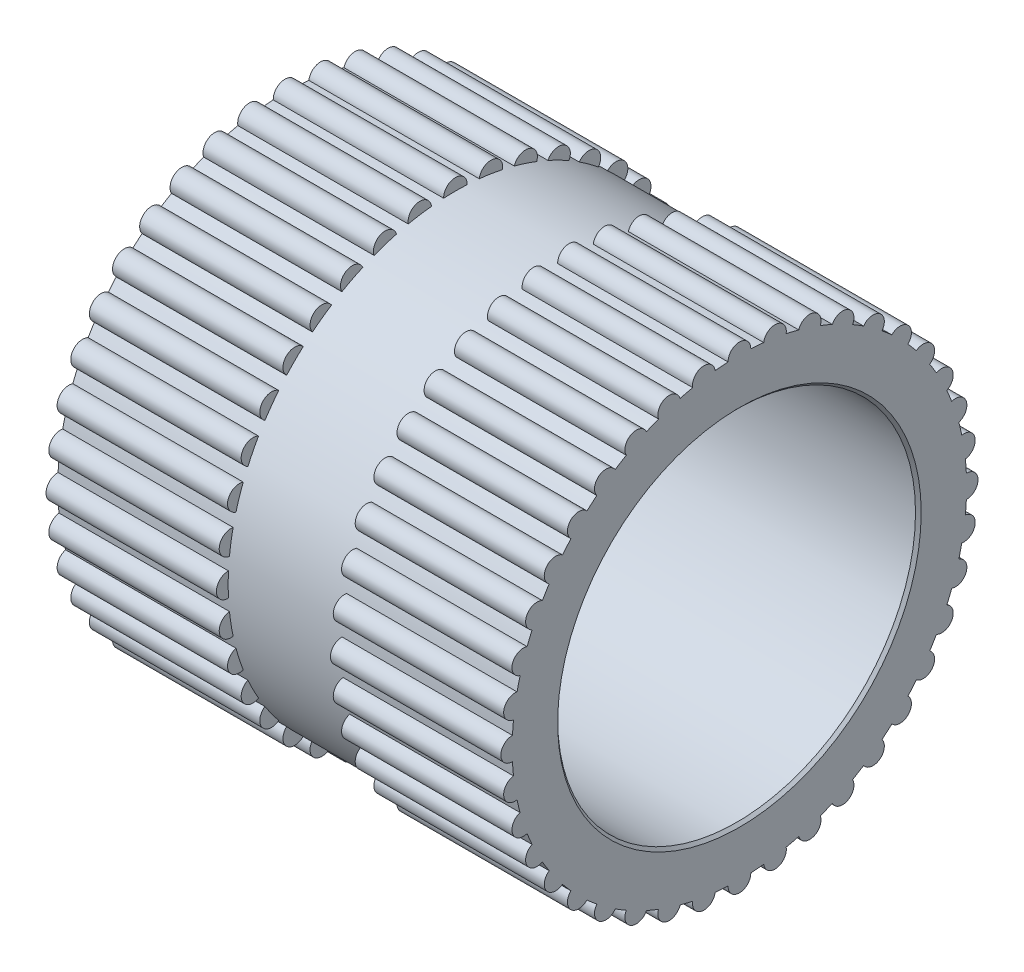
from build123d import *

# Parameters (mm, degrees)
SKETCH_1_R                  = 2
EXTRUDE_1_DEPTH             = 4
HOLE_WIZARD_M31_D           = 3.15
HOLE_WIZARD_M31_CSINK_D     = 3.2
HOLE_WIZARD_M31_CSINK_ANGLE = 90
SKETCH_4_R                  = 0.1
EXTRUDE_2_DEPTH             = 1.5
SKETCH_5_R                  = 0.103701004
EXTRUDE_3_DEPTH             = 1.5


with BuildPart() as part:
    # Эскиз1 → Бобышка-Вытянуть1 (new body)
    with BuildSketch(Plane(origin=(0, 0, 0), x_dir=(0, 0, -1), z_dir=(1, 0, 0))):
        Circle(SKETCH_1_R)
    extrude(amount=EXTRUDE_1_DEPTH)

    # Сверло под метчик  спиральное M31 (through all)
    with Locations(Plane(origin=(4, 0, 0), x_dir=(0, 0, -1), z_dir=(1, 0, 0))):
        with Locations((0, 0)):
            CounterSinkHole(HOLE_WIZARD_M31_D / 2, HOLE_WIZARD_M31_CSINK_D / 2, counter_sink_angle=HOLE_WIZARD_M31_CSINK_ANGLE)

    # Эскиз4 → Бобышка-Вытянуть2 (add)
    with BuildSketch(Plane(origin=(4, 0, 0), x_dir=(0, 0, -1), z_dir=(1, 0, 0))):
        with Locations((0, 2)):
            Circle(SKETCH_4_R)
        with Locations((0.31286893, 1.975376681)):
            Circle(SKETCH_4_R)
        with Locations((0.618033989, 1.902113033)):
            Circle(SKETCH_4_R)
        with Locations((0.907980999, 1.782013048)):
            Circle(SKETCH_4_R)
        with Locations((1.175570505, 1.618033989)):
            Circle(SKETCH_4_R)
        with Locations((1.414213562, 1.414213562)):
            Circle(SKETCH_4_R)
        with Locations((1.618033989, 1.175570505)):
            Circle(SKETCH_4_R)
        with Locations((1.782013048, 0.907980999)):
            Circle(SKETCH_4_R)
        with Locations((1.902113033, 0.618033989)):
            Circle(SKETCH_4_R)
        with Locations((1.975376681, 0.31286893)):
            Circle(SKETCH_4_R)
        with Locations((2, 0)):
            Circle(SKETCH_4_R)
        with Locations((1.975376681, -0.31286893)):
            Circle(SKETCH_4_R)
        with Locations((1.902113033, -0.618033989)):
            Circle(SKETCH_4_R)
        with Locations((1.782013048, -0.907980999)):
            Circle(SKETCH_4_R)
        with Locations((1.618033989, -1.175570505)):
            Circle(SKETCH_4_R)
        with Locations((1.414213562, -1.414213562)):
            Circle(SKETCH_4_R)
        with Locations((1.175570505, -1.618033989)):
            Circle(SKETCH_4_R)
        with Locations((0.907980999, -1.782013048)):
            Circle(SKETCH_4_R)
        with Locations((0.618033989, -1.902113033)):
            Circle(SKETCH_4_R)
        with Locations((0.31286893, -1.975376681)):
            Circle(SKETCH_4_R)
        with Locations((0, -2)):
            Circle(SKETCH_4_R)
        with Locations((-0.31286893, -1.975376681)):
            Circle(SKETCH_4_R)
        with Locations((-0.618033989, -1.902113033)):
            Circle(SKETCH_4_R)
        with Locations((-0.907980999, -1.782013048)):
            Circle(SKETCH_4_R)
        with Locations((-1.175570505, -1.618033989)):
            Circle(SKETCH_4_R)
        with Locations((-1.414213562, -1.414213562)):
            Circle(SKETCH_4_R)
        with Locations((-1.618033989, -1.175570505)):
            Circle(SKETCH_4_R)
        with Locations((-1.782013048, -0.907980999)):
            Circle(SKETCH_4_R)
        with Locations((-1.902113033, -0.618033989)):
            Circle(SKETCH_4_R)
        with Locations((-1.975376681, -0.31286893)):
            Circle(SKETCH_4_R)
        with Locations((-2, 0)):
            Circle(SKETCH_4_R)
        with Locations((-1.975376681, 0.31286893)):
            Circle(SKETCH_4_R)
        with Locations((-1.902113033, 0.618033989)):
            Circle(SKETCH_4_R)
        with Locations((-1.782013048, 0.907980999)):
            Circle(SKETCH_4_R)
        with Locations((-1.618033989, 1.175570505)):
            Circle(SKETCH_4_R)
        with Locations((-1.414213562, 1.414213562)):
            Circle(SKETCH_4_R)
        with Locations((-1.175570505, 1.618033989)):
            Circle(SKETCH_4_R)
        with Locations((-0.907980999, 1.782013048)):
            Circle(SKETCH_4_R)
        with Locations((-0.618033989, 1.902113033)):
            Circle(SKETCH_4_R)
        with Locations((-0.31286893, 1.975376681)):
            Circle(SKETCH_4_R)
    extrude(amount=-EXTRUDE_2_DEPTH)

    # Эскиз5 → Бобышка-Вытянуть3 (add)
    with BuildSketch(Plane.ZY):
        with Locations((0, 2)):
            Circle(SKETCH_5_R)
        with Locations((0.31286893, 1.975376681)):
            Circle(SKETCH_5_R)
        with Locations((0.618033989, 1.902113033)):
            Circle(SKETCH_5_R)
        with Locations((0.907980999, 1.782013048)):
            Circle(SKETCH_5_R)
        with Locations((1.175570505, 1.618033989)):
            Circle(SKETCH_5_R)
        with Locations((1.414213562, 1.414213562)):
            Circle(SKETCH_5_R)
        with Locations((1.618033989, 1.175570505)):
            Circle(SKETCH_5_R)
        with Locations((1.782013048, 0.907980999)):
            Circle(SKETCH_5_R)
        with Locations((1.902113033, 0.618033989)):
            Circle(SKETCH_5_R)
        with Locations((1.975376681, 0.31286893)):
            Circle(SKETCH_5_R)
        with Locations((2, 0)):
            Circle(SKETCH_5_R)
        with Locations((1.975376681, -0.31286893)):
            Circle(SKETCH_5_R)
        with Locations((1.902113033, -0.618033989)):
            Circle(SKETCH_5_R)
        with Locations((1.782013048, -0.907980999)):
            Circle(SKETCH_5_R)
        with Locations((1.618033989, -1.175570505)):
            Circle(SKETCH_5_R)
        with Locations((1.414213562, -1.414213562)):
            Circle(SKETCH_5_R)
        with Locations((1.175570505, -1.618033989)):
            Circle(SKETCH_5_R)
        with Locations((0.907980999, -1.782013048)):
            Circle(SKETCH_5_R)
        with Locations((0.618033989, -1.902113033)):
            Circle(SKETCH_5_R)
        with Locations((0.31286893, -1.975376681)):
            Circle(SKETCH_5_R)
        with Locations((0, -2)):
            Circle(SKETCH_5_R)
        with Locations((-0.31286893, -1.975376681)):
            Circle(SKETCH_5_R)
        with Locations((-0.618033989, -1.902113033)):
            Circle(SKETCH_5_R)
        with Locations((-0.907980999, -1.782013048)):
            Circle(SKETCH_5_R)
        with Locations((-1.175570505, -1.618033989)):
            Circle(SKETCH_5_R)
        with Locations((-1.414213562, -1.414213562)):
            Circle(SKETCH_5_R)
        with Locations((-1.618033989, -1.175570505)):
            Circle(SKETCH_5_R)
        with Locations((-1.782013048, -0.907980999)):
            Circle(SKETCH_5_R)
        with Locations((-1.902113033, -0.618033989)):
            Circle(SKETCH_5_R)
        with Locations((-1.975376681, -0.31286893)):
            Circle(SKETCH_5_R)
        with Locations((-2, 0)):
            Circle(SKETCH_5_R)
        with Locations((-1.975376681, 0.31286893)):
            Circle(SKETCH_5_R)
        with Locations((-1.902113033, 0.618033989)):
            Circle(SKETCH_5_R)
        with Locations((-1.782013048, 0.907980999)):
            Circle(SKETCH_5_R)
        with Locations((-1.618033989, 1.175570505)):
            Circle(SKETCH_5_R)
        with Locations((-1.414213562, 1.414213562)):
            Circle(SKETCH_5_R)
        with Locations((-1.175570505, 1.618033989)):
            Circle(SKETCH_5_R)
        with Locations((-0.907980999, 1.782013048)):
            Circle(SKETCH_5_R)
        with Locations((-0.618033989, 1.902113033)):
            Circle(SKETCH_5_R)
        with Locations((-0.31286893, 1.975376681)):
            Circle(SKETCH_5_R)
    extrude(amount=-EXTRUDE_3_DEPTH)


solid = part.part
